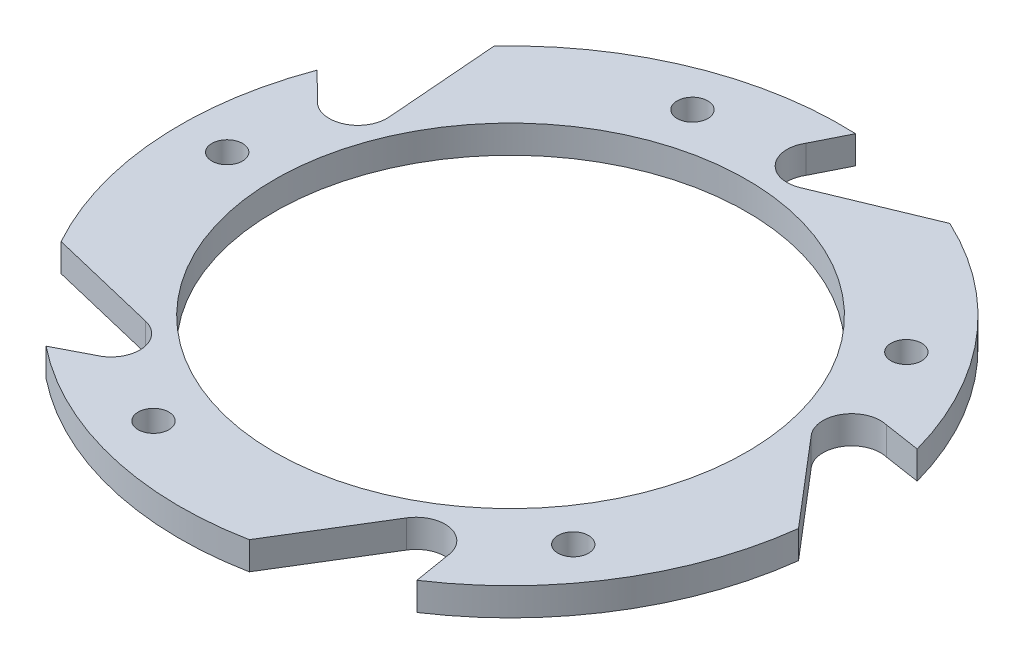
from build123d import *

# Parameters (mm, degrees)
SKETCH1_R           = 3.3
SKETCH1_R_2         = 50.8
BOSS_EXTRUDE1_DEPTH = 6


with BuildPart() as part:
    # Sketch1 → Boss-Extrude1 (new body)
    with BuildSketch(Plane(origin=(0, 0, 0), x_dir=(1, 0, 0), z_dir=(0, 1, 0))):
        with BuildLine():
            ThreePointArc((-50.084292244, 23.446975703), (-54.118923856, 17.647036419), (-60.96, 19.41260294))
            Line((-60.96, 19.41260294), (-66.591321273, 24.972992034))
            ThreePointArc((-66.591321273, 24.972992034), (-70.926140308, -5.247572863), (-62.191041695, -34.501141038))
            Line((-62.191041695, -34.501141038), (-38.242542673, -40.255931215))
            ThreePointArc((-38.242542673, -40.255931215), (-34.829443057, -42.441548483), (-33.501782647, -46.270842108))
            ThreePointArc((-33.501782647, -46.270842108), (-34.53819598, -49.698469864), (-37.300158502, -51.97758102))
            Line((-37.300158502, -51.97758102), (-44.328576757, -55.615031086))
            ThreePointArc((-44.328576757, -55.615031086), (-16.926644335, -69.07635711), (13.594446222, -69.808634365))
            Line((13.594446222, -69.808634365), (26.468070107, -48.810586278))
            ThreePointArc((26.468070107, -48.810586278), (33.175934652, -46.026293541), (37.90723426, -51.536514664))
            Line((37.90723426, -51.536514664), (39.194754164, -59.344971531))
            ThreePointArc((39.194754164, -59.344971531), (60.464898794, -37.44396365), (70.592871518, -8.642967708))
            Line((70.592871518, -8.642967708), (54.600709616, 10.089329884))
            ThreePointArc((54.600709616, 10.089329884), (54.025534005, 17.329281943), (60.728117694, 20.126263296))
            Line((60.728117694, 20.126263296), (68.552267011, 18.937821619))
            ThreePointArc((68.552267011, 18.937821619), (54.296006916, 45.9347149), (30.03434774, 64.466986558))
            Line((30.03434774, 64.466986558), (7.277024245, 55.04613507))
            ThreePointArc((7.277024245, 55.04613507), (0.213681623, 56.736378783), (-0.375193452, 63.975229447))
            Line((-0.375193452, 63.975229447), (3.172876855, 71.049188964))
            ThreePointArc((3.172876855, 71.049188964), (-26.908121067, 65.833178722), (-52.030623785, 48.485756553))
            Line((-52.030623785, 48.485756553), (-50.103261295, 23.931052539))
            ThreePointArc((-50.103261295, 23.931052539), (-50.089036326, 23.68919988), (-50.084292244, 23.446975703))
        make_face()
        with Locations(Location((-18.837675977, -57.976405233, 0), (0, 0, 270))):
            Circle(SKETCH1_R, mode=Mode.SUBTRACT)
        with Locations(Location((-60.96, 0, 0), (0, 0, 270))):
            Circle(SKETCH1_R, mode=Mode.SUBTRACT)
        with Locations(Location((49.317675977, -35.83138898, 0), (0, 0, 270))):
            Circle(SKETCH1_R, mode=Mode.SUBTRACT)
        with Locations(Location((-18.837675977, 57.976405233, 0), (0, 0, 270))):
            Circle(SKETCH1_R, mode=Mode.SUBTRACT)
        with Locations(Location((0, 0, 0), (0, 0, 270))):
            Circle(SKETCH1_R_2, mode=Mode.SUBTRACT)
        with Locations(Location((49.317675977, 35.83138898, 0), (0, 0, 270))):
            Circle(SKETCH1_R, mode=Mode.SUBTRACT)
    extrude(amount=BOSS_EXTRUDE1_DEPTH)


solid = part.part
